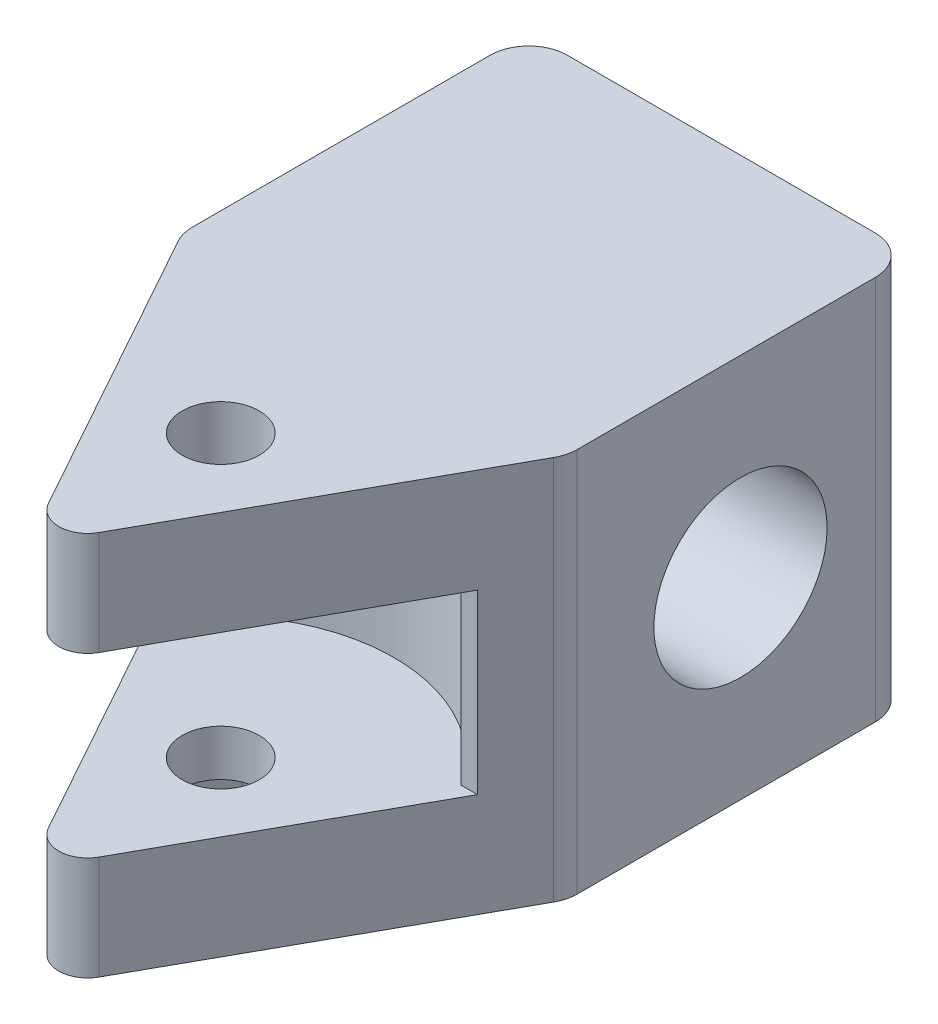
from build123d import *

# Parameters (mm, degrees)
SKETCH2_R                      = 2
BOSS_EXTRUDE1_DEPTH            = 10
CUT_EXTRUDE2_DEPTH             = 31.479501308
CUT_EXTRUDE2_DEPTH_BACK        = 31.479501308
SKETCH4_W                      = 15
SKETCH4_H                      = 9.2
CUT_EXTRUDE1_REACH             = 37.057
SKETCH3_R                      = 4.5
FILLET3_R                      = 1.5
FILLET4_R                      = 2
CUT_EXTRUDE3_REACH             = 31.082
SKETCH5_R                      = 9
CUT_EXTRUDE3_DIRECTION_2_REACH = 31.082
CUT_EXTRUDE4_DEPTH             = 3


with BuildPart() as part:
    # Sketch2 → Boss-Extrude1 (new, symmetric)
    with BuildSketch(Plane(origin=(0, 0, 0), x_dir=(1, 0, 0), z_dir=(0, 1, 0))):
        Polygon((-10, -9), (0, -27), (10, -9), (10, 9), (-10, 9), align=None)
        with Locations(Location((0, -17, 0), (0, 0, 270))):
            Circle(SKETCH2_R, mode=Mode.SUBTRACT)
    extrude(amount=BOSS_EXTRUDE1_DEPTH, both=True)

    # Sketch4 → Cut-Extrude2 (cut, two sides: drawn at the far end of the back side and taken through both)
    with BuildSketch(Plane(origin=(0, 0, 0), x_dir=(0, 0, -1), z_dir=(1, 0, 0)).offset(-CUT_EXTRUDE2_DEPTH_BACK)):
        with Locations((-19.5, 0)):
            Rectangle(SKETCH4_W, SKETCH4_H)
    extrude(amount=CUT_EXTRUDE2_DEPTH + CUT_EXTRUDE2_DEPTH_BACK, mode=Mode.SUBTRACT)

    # Sketch3 → Cut-Extrude1 (cut, up to next)
    with BuildSketch(Plane(origin=(10, 0, 0), x_dir=(0, 0, -1), z_dir=(1, 0, 0)), mode=Mode.PRIVATE) as cut_extrude1_sk1:
        Circle(SKETCH3_R)
    cut_extrude1_tool1 = extrude(cut_extrude1_sk1.sketch, amount=-CUT_EXTRUDE1_REACH, mode=Mode.PRIVATE) & part.part
    add(cut_extrude1_tool1.solids().sort_by_distance((10, 0, 0))[0], mode=Mode.SUBTRACT)

    # Fillet3
    fillet3_edges = [part.edges().sort_by_distance(p)[0] for p in [
        (0, 7.3, 27),
        (0, -7.3, 27),
    ]]
    fillet(fillet3_edges, radius=FILLET3_R)

    # Fillet4
    fillet4_edges = [part.edges().sort_by_distance(p)[0] for p in [
        (10, 0, 9),
        (-10, 0, 9),
        (-10, 0, -9),
        (10, 0, -9),
    ]]
    fillet(fillet4_edges, radius=FILLET4_R)

    # Cut-Extrude3: up to this face of the body (flat: up to its plane)
    cut_extrude3_end = Plane(part.part.faces().sort_by_distance((-4.635280123, -4.6, 18.215996288))[0])
    # Sketch5 → Cut-Extrude3 (cut, up to the picked face)
    with BuildSketch(Plane(origin=(0, 0, 0), x_dir=(1, 0, 0), z_dir=(0, 1, 0)), mode=Mode.PRIVATE) as cut_extrude3_sk1:
        with Locations((0, -17)):
            Circle(SKETCH5_R)
    cut_extrude3_tool1 = split(extrude(cut_extrude3_sk1.sketch, amount=-CUT_EXTRUDE3_REACH, mode=Mode.PRIVATE), bisect_by=cut_extrude3_end, keep=Keep.BOTH, mode=Mode.PRIVATE)
    add(cut_extrude3_tool1.solids().sort_by(Axis((0, 0, 17), (0, -1, 0)))[0], mode=Mode.SUBTRACT)

    # Cut-Extrude3 direction 2: up to this face of the body (flat: up to its plane)
    cut_extrude3_direction_2_end = Plane(part.part.faces().sort_by_distance((-4.635280123, 4.6, 18.215996288))[0])
    # Sketch5 → Cut-Extrude3 direction 2 (cut, up to the picked face)
    with BuildSketch(Plane(origin=(0, 0, 0), x_dir=(1, 0, 0), z_dir=(0, 1, 0)), mode=Mode.PRIVATE) as cut_extrude3_direction_2_sk1:
        with Locations((0, -17)):
            Circle(SKETCH5_R)
    cut_extrude3_direction_2_tool1 = split(extrude(cut_extrude3_direction_2_sk1.sketch, amount=CUT_EXTRUDE3_DIRECTION_2_REACH, mode=Mode.PRIVATE), bisect_by=cut_extrude3_direction_2_end, keep=Keep.BOTH, mode=Mode.PRIVATE)
    add(cut_extrude3_direction_2_tool1.solids().sort_by(Axis((0, 0, 17), (0, 1, 0)))[0], mode=Mode.SUBTRACT)

    # Sketch8 → Cut-Extrude4 (cut)
    with BuildSketch(Plane.XZ.offset(10)):
        with BuildLine():
            Line((2.205478028, 13.66), (3.100370946, 15.21))
            Line((3.100370946, 15.21), (3.995263863, 16.76))
            ThreePointArc((3.995263863, 16.76), (4.059571669, 17), (3.995263863, 17.24))
            Line((3.995263863, 17.24), (3.100370946, 18.79))
            Line((3.100370946, 18.79), (2.205478028, 20.34))
            ThreePointArc((2.205478028, 20.34), (2.029785834, 20.515692194), (1.789785834, 20.58))
            Line((1.789785834, 20.58), (0, 20.58))
            Line((0, 20.58), (-1.789785834, 20.58))
            ThreePointArc((-1.789785834, 20.58), (-2.029785834, 20.515692194), (-2.205478028, 20.34))
            Line((-2.205478028, 20.34), (-3.100370946, 18.79))
            Line((-3.100370946, 18.79), (-3.995263863, 17.24))
            ThreePointArc((-3.995263863, 17.24), (-4.059571669, 17), (-3.995263863, 16.76))
            Line((-3.995263863, 16.76), (-3.100370946, 15.21))
            Line((-3.100370946, 15.21), (-2.205478028, 13.66))
            ThreePointArc((-2.205478028, 13.66), (-2.029785834, 13.484307806), (-1.789785834, 13.42))
            Line((-1.789785834, 13.42), (0, 13.42))
            Line((0, 13.42), (1.789785834, 13.42))
            ThreePointArc((1.789785834, 13.42), (2.029785834, 13.484307806), (2.205478028, 13.66))
        make_face()
    extrude(amount=-CUT_EXTRUDE4_DEPTH, mode=Mode.SUBTRACT)


solid = part.part
